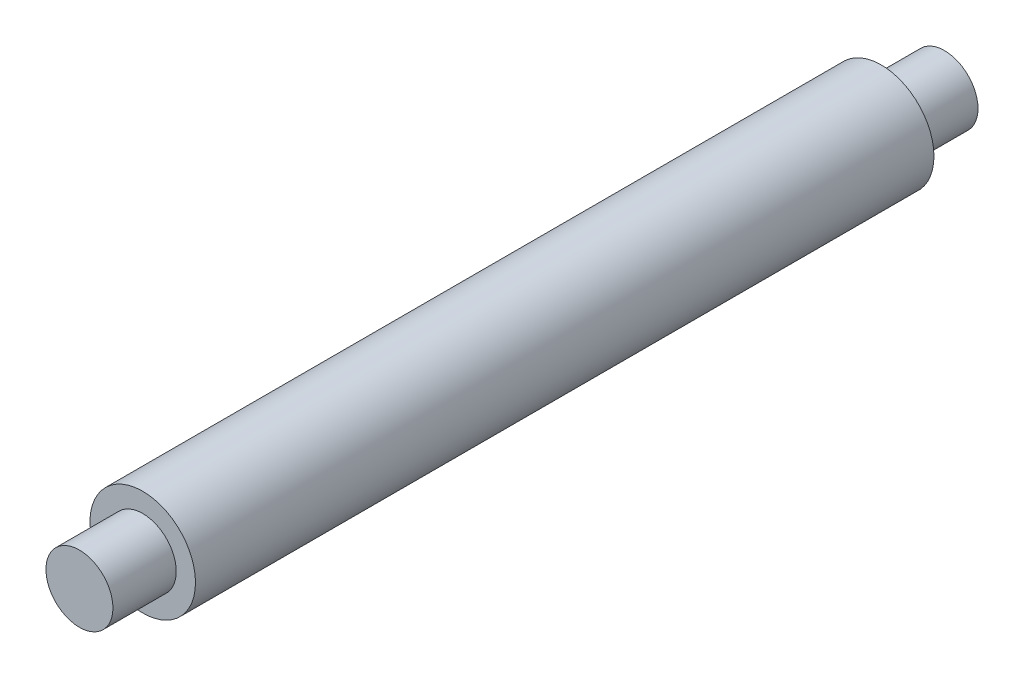
from build123d import *

# Parameters (mm, degrees)
SKETCH1_R           = 3.175
BOSS_EXTRUDE1_DEPTH = 41
SKETCH2_R           = 5
SKETCH2_R_2         = 3.175
BOSS_EXTRUDE2_DEPTH = 35


with BuildPart() as part:
    # Sketch1 → Boss-Extrude1 (new, symmetric)
    with BuildSketch(Plane.XY):
        Circle(SKETCH1_R)
    extrude(amount=BOSS_EXTRUDE1_DEPTH, both=True)


with BuildPart() as body_2:
    # Sketch2 → Boss-Extrude2 (new, symmetric)
    with BuildSketch(Plane.XY):
        Circle(SKETCH2_R)
        Circle(SKETCH2_R_2, mode=Mode.SUBTRACT)
    extrude(amount=BOSS_EXTRUDE2_DEPTH, both=True)


solid = Compound([part.part, body_2.part])
